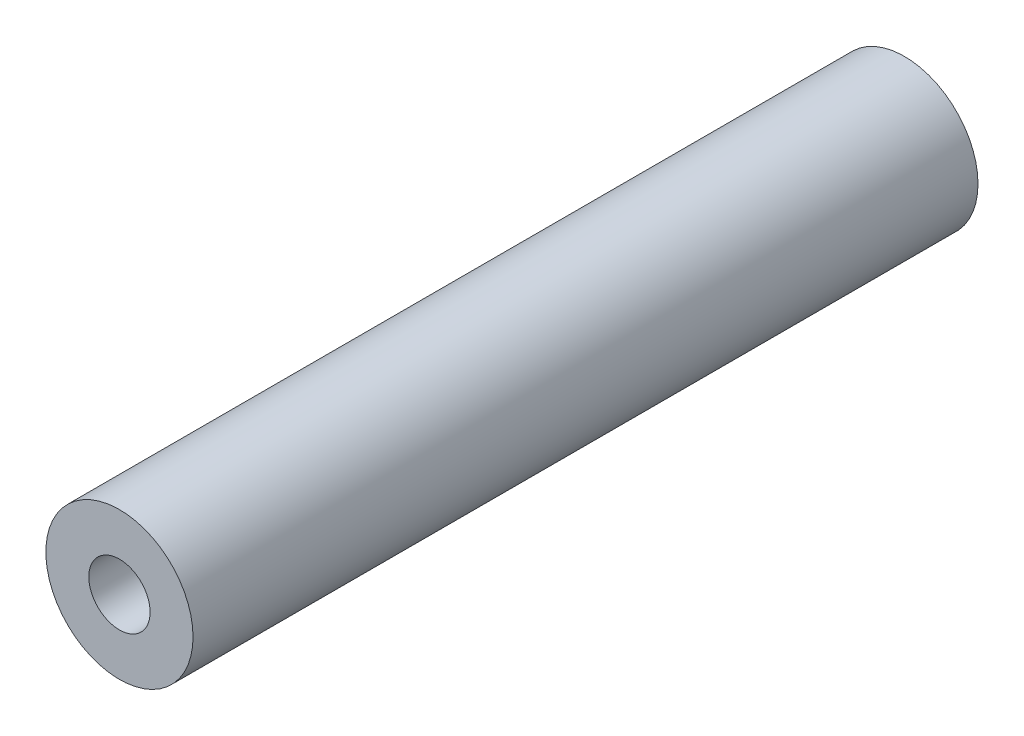
from build123d import *

# Parameters (mm, degrees)
SKETCH1_R           = 3
BOSS_EXTRUDE1_DEPTH = 32
M3_TAPPED_HOLE1_D   = 2.5


with BuildPart() as part:
    # Sketch1 → Boss-Extrude1 (new body)
    with BuildSketch(Plane.XY):
        Circle(SKETCH1_R)
    extrude(amount=BOSS_EXTRUDE1_DEPTH)

    # M3 Tapped Hole1 (through all)
    with Locations(Plane.XY.offset(32)):
        with Locations((0, 0)):
            Hole(M3_TAPPED_HOLE1_D / 2)


solid = part.part
